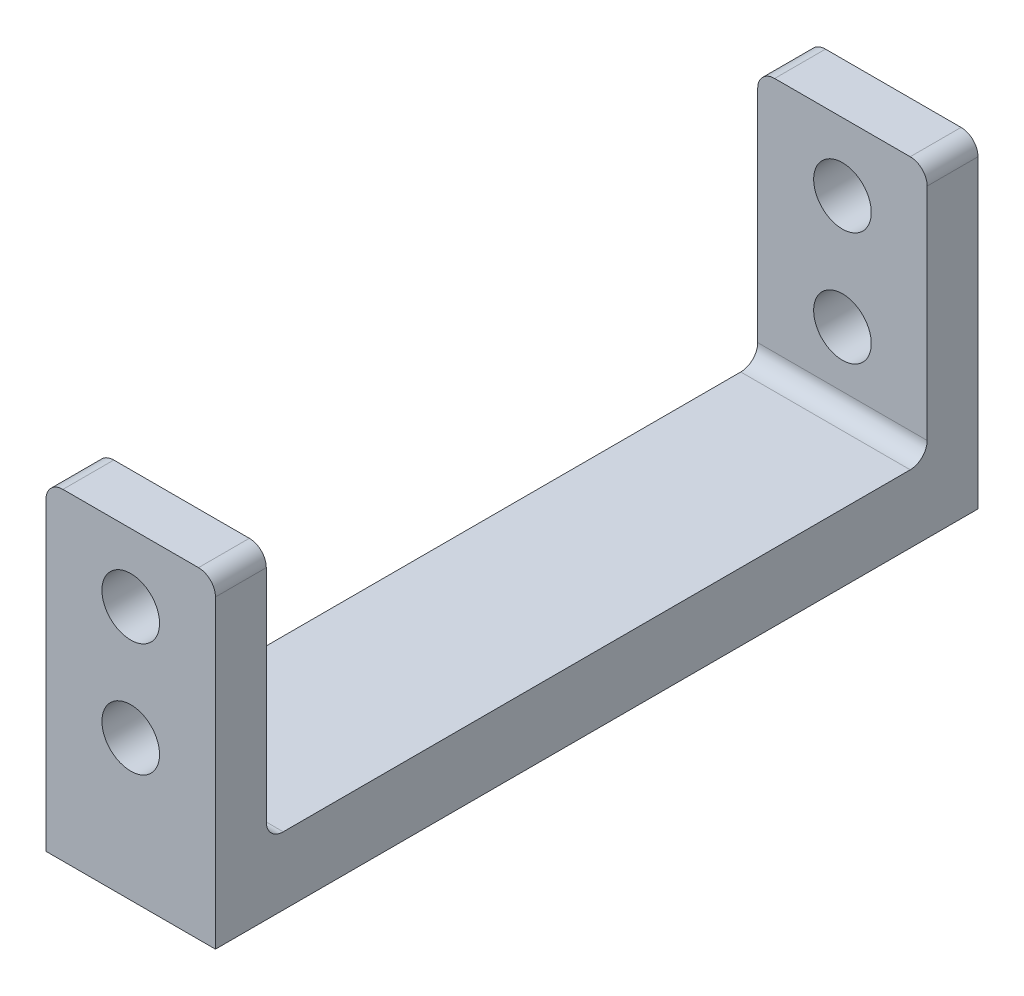
from build123d import *

# Parameters (mm, degrees)
SKETCH2_W                      = 10
SKETCH2_H                      = 45
BOSS_EXTRUDE1_DEPTH            = 4
SKETCH3_W                      = 10
SKETCH3_H                      = 3
BOSS_EXTRUDE2_DEPTH            = 15
M3_CLEARANCE_HOLE1_D           = 3.4
M3_CLEARANCE_HOLE1_ON_FACE_2_D = 3.4
FILLET1_R                      = 1


with BuildPart() as part:
    # Sketch2 → Boss-Extrude1 (new body)
    with BuildSketch(Plane(origin=(0, 0, 0), x_dir=(1, 0, 0), z_dir=(0, 1, 0))):
        Rectangle(SKETCH2_W, SKETCH2_H)
    extrude(amount=BOSS_EXTRUDE1_DEPTH)

    # Sketch3 → Boss-Extrude2 (add)
    with BuildSketch(Plane(origin=(0, 4, 0), x_dir=(1, 0, 0), z_dir=(0, 1, 0))):
        with Locations((0, 21)):
            Rectangle(SKETCH3_W, SKETCH3_H)
        with Locations((0, -21)):
            Rectangle(SKETCH3_W, SKETCH3_H)
    extrude(amount=BOSS_EXTRUDE2_DEPTH)

    # M3 Clearance Hole1 (through all)
    with Locations(Plane(origin=(0, 15, -22.5), x_dir=(-1, 0, 0), z_dir=(0, 0, -1))):
        with Locations((0, 0), (0, -6.7)):
            Hole(M3_CLEARANCE_HOLE1_D / 2)

    # M3 Clearance Hole1 on face 2 (through all)
    with Locations(Plane(origin=(0, 15, 22.5), x_dir=(1, 0, 0), z_dir=(0, 0, 1))):
        with Locations((0, 0), (0, -6.7)):
            Hole(M3_CLEARANCE_HOLE1_ON_FACE_2_D / 2)

    # Fillet1
    fillet1_edges = [part.edges().sort_by_distance(p)[0] for p in [
        (0, 4, -19.5),
        (-5, 19, -21),
        (5, 19, -21),
        (0, 4, 19.5),
        (5, 19, 21),
        (-5, 19, 21),
    ]]
    fillet(fillet1_edges, radius=FILLET1_R)


solid = part.part
